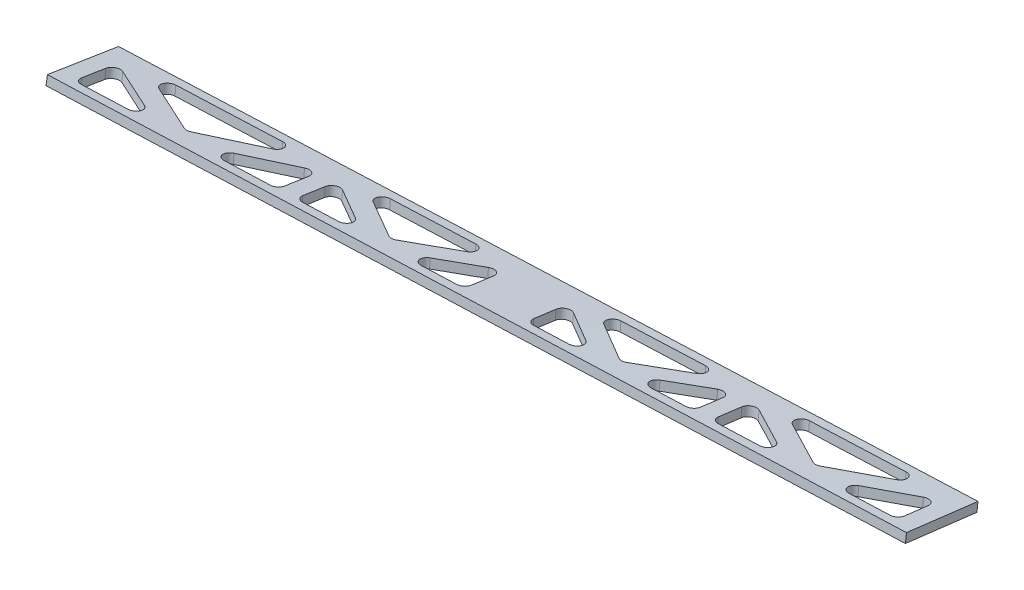
from build123d import *

# Parameters (mm, degrees)
CUT_EXTRUDE2_DEPTH      = 304.404892821
CUT_EXTRUDE2_DEPTH_BACK = 304.404892821
FILLET1_R               = 2.54


with BuildPart() as part:
    # Sketch1 → Loft1 section 0
    with BuildSketch(Plane(origin=(0, 0, 0), x_dir=(0, 0, -1), z_dir=(1, 0, 0))):
        with BuildLine():
            Line((5.924524399, -3.873191473), (31.13772874, -6.947980383))
            Line((31.13772874, -6.947980383), (31.522077354, -3.79632984))
            Line((31.522077354, -3.79632984), (6.308873012, -0.72154093))
            Line((6.308873012, -0.72154093), (5.924524399, -3.873191473))
        make_face()
    # Sketch2 → Loft1 section 1
    with BuildSketch(Plane(origin=(-301.244, 0, 0), x_dir=(0, 0, -1), z_dir=(1, 0, 0))):
        with BuildLine():
            Line((29.66416581, -14.543476344), (4.571250508, -10.60576106))
            Line((4.571250508, -10.60576106), (4.079036097, -13.742375473))
            Line((4.079036097, -13.742375473), (29.171951399, -17.680090757))
            Line((29.171951399, -17.680090757), (29.66416581, -14.543476344))
        make_face()
    loft()

    # Sketch3 → Cut-Extrude2 (cut, two sides: drawn at the far end of the back side and taken through both)
    with BuildSketch(Plane(origin=(-0.001577966, 0.047082695, -0.005741807), x_dir=(0.9994470688717862, 0.03300538497704527, -0.004025057280588651), z_dir=(-0.033249910129126446, 0.9920969754260035, -0.12098774659849161)).offset(-CUT_EXTRUDE2_DEPTH_BACK)):
        Polygon((-295.088054809, 24.431002398), (-266.18852591, 9.058250028), (-295.088054809, 9.00759554), align=None)
        Polygon((-288.350897254, 28.039754294), (-259.455267738, 12.669076153), (-230.559638223, 28.146992017), align=None)
        Polygon((-252.708932717, 9.079145758), (-223.812085822, 24.55771371), (-223.812085822, 9.118088647), align=None)
        Polygon((-193.794207841, 9.18514127), (-217.462085822, 24.397057709), (-217.462085822, 9.14365671), align=None)
        Polygon((-211.606738616, 28.182161104), (-187.942878373, 12.972826962), (-164.27901813, 28.269982637), align=None)
        Polygon((-182.073610805, 9.205684886), (-158.41376702, 24.500244181), (-158.41376702, 9.247155364), align=None)
        Polygon((-136.436196911, 24.535208515), (-113.031441325, 9.326700553), (-136.436196911, 9.285677188), align=None)
        Polygon((-130.625742607, 28.332429808), (-107.22500602, 13.126533409), (-83.824269433, 28.419274835), align=None)
        Polygon((-101.400662031, 9.347086739), (-78.003943175, 24.637202516), (-78.003943175, 9.388096017), align=None)
        Polygon((-71.653943175, 24.769175799), (-45.299064717, 9.445420442), (-71.653943175, 9.399226164), align=None)
        Polygon((-65.357498741, 28.453541858), (-39.00669553, 13.132156009), (-12.65906818, 28.551329305), align=None)
        Polygon((-32.696565695, 9.467509838), (-6.352252536, 24.884743602), (-6.349077075, 9.513691163), align=None)
    extrude(amount=CUT_EXTRUDE2_DEPTH + CUT_EXTRUDE2_DEPTH_BACK, mode=Mode.SUBTRACT)

    # Fillet1
    fillet1_edges = [part.edges().sort_by_distance(p)[0] for p in [
        (-6.2943144, -2.890468589, -9.231677641),
        (-6.297121855, -4.762239274, -24.488343434),
        (-32.626920354, -3.763865657, -9.078642064),
        (-65.264700348, -7.29218722, -27.775050617),
        (-12.59983325, -5.432665724, -28.100334033),
        (-38.93294423, -4.434163063, -12.688694498),
        (-45.22230037, -4.18163824, -9.005441009),
        (-71.558128809, -7.040103837, -24.094130356),
        (-71.562290537, -5.055323566, -8.852357229),
        (-130.491371552, -9.595353444, -27.37216664),
        (-107.111721102, -6.739167183, -12.401931457),
        (-83.719709011, -7.94382528, -27.661061461),
        (-112.916411898, -6.427079868, -8.612006519),
        (-136.307943572, -7.20303167, -8.476050715),
        (-136.300077651, -9.283758908, -23.584812517),
        (-158.263959453, -10.050741704, -23.456054418),
        (-181.919569661, -8.716142508, -8.210939593),
        (-158.273095438, -7.931688182, -8.348382718),
        (-164.12321007, -10.782945632, -27.164428133),
        (-211.420781224, -12.453148406, -26.872272173),
        (-187.782835855, -9.448124704, -11.916724733),
        (-193.633543399, -9.1047537, -8.142852046),
        (-217.288046094, -9.889509749, -8.005357938),
        (-217.275501898, -12.11029387, -23.10093793),
        (-223.621401289, -12.356915369, -23.232708305),
        (-252.514975291, -11.057825116, -7.797891198),
        (-223.634469643, -10.097948352, -7.954181044),
        (-230.361606629, -13.122016417, -26.755273052),
        (-288.11604692, -15.161592143, -26.398511458),
        (-259.253962783, -11.822999005, -11.321103982),
        (-265.986947205, -11.50520723, -7.722281725),
        (-294.852925834, -14.844261773, -22.801722528),
        (-294.870141219, -12.463520696, -7.55438416),
        (-101.292203818, -6.04148631, -8.679567464),
        (-77.908703174, -5.26583553, -8.815472366),
        (-77.904207933, -7.245938386, -23.936077491),
    ]]
    fillet(fillet1_edges, radius=FILLET1_R)


solid = part.part
